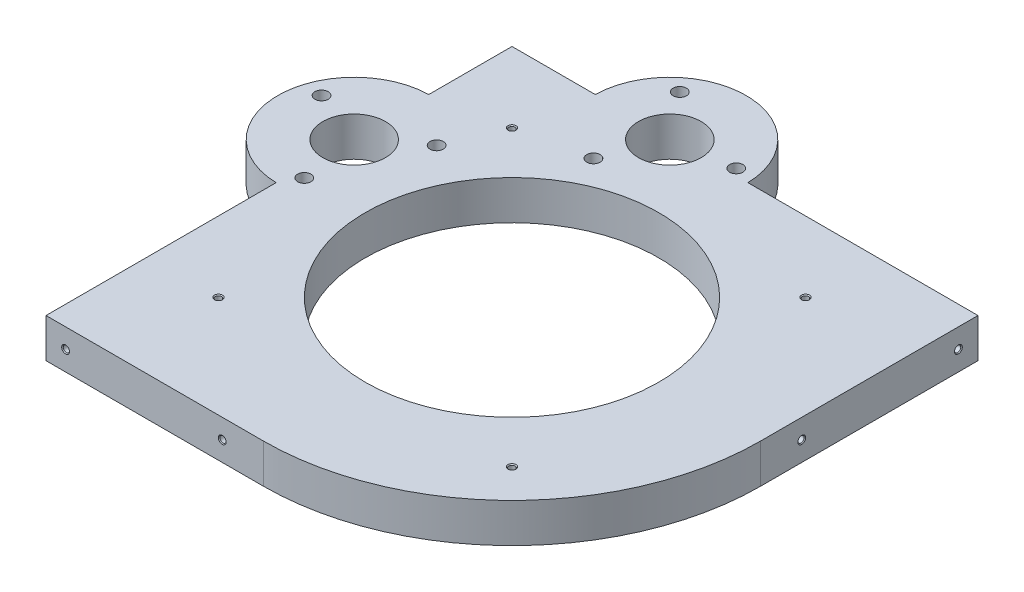
from build123d import *

# Parameters (mm, degrees)
SKETCH1_R                           = 37.5
BOSS_EXTRUDE1_DEPTH                 = 10
M2X0_4_TAPPED_HOLE2_D               = 1.6
M2X0_4_TAPPED_HOLE2_CSINK_D         = 2.05
M2X0_4_TAPPED_HOLE2_CSINK_ANGLE     = 90
M2X0_4_TAPPED_HOLE1_D               = 1.6
M2X0_4_TAPPED_HOLE1_DEPTH           = 6
M2X0_4_TAPPED_HOLE1_TIP             = 0.480688495
M2X0_4_TAPPED_HOLE1_ON_FACE_2_D     = 1.6
M2X0_4_TAPPED_HOLE1_ON_FACE_2_DEPTH = 6
M2X0_4_TAPPED_HOLE1_ON_FACE_2_TIP   = 0.480688495
CHAMFER1_SIZE                       = 0.2
SKETCH11_R                          = 19.5
BOSS_EXTRUDE2_DEPTH                 = 10
SKETCH12_R                          = 8
CUT_EXTRUDE1_DEPTH                  = 106.913751518
M3_CLEARANCE_HOLE1_D                = 3.4


with BuildPart() as part:
    # Sketch1 → Boss-Extrude1 (new body)
    with BuildSketch(Plane(origin=(0, 0, 0), x_dir=(1, 0, 0), z_dir=(0, 1, 0))):
        with BuildLine():
            Line((-55.5, 55.5), (63.5, 55.5))
            Line((63.5, 55.5), (63.5, 0))
            ThreePointArc((63.5, 0), (44.901280605, -44.901280605), (0, -63.5))
            Line((0, -63.5), (-55.5, -63.5))
            Line((-55.5, -63.5), (-55.5, 55.5))
        make_face()
        with Locations(Location((0, 0, 0), (0, 0, 270))):
            Circle(SKETCH1_R, mode=Mode.SUBTRACT)
    extrude(amount=BOSS_EXTRUDE1_DEPTH)

    # M2x0.4 Tapped Hole2 (through all)
    with Locations(Plane(origin=(0, 10, 0), x_dir=(1, 0, 0), z_dir=(0, 1, 0))):
        with Locations((37.476659403, 37.476659403), (-37.476659403, 37.476659403), (-37.476659403, -37.476659403), (37.476659403, -37.476659403)):
            CounterSinkHole(M2X0_4_TAPPED_HOLE2_D / 2, M2X0_4_TAPPED_HOLE2_CSINK_D / 2, counter_sink_angle=M2X0_4_TAPPED_HOLE2_CSINK_ANGLE)

    # M2x0.4 Tapped Hole1
    with Locations(Plane(origin=(63.5, 5, -50.5), x_dir=(0, 0, 1), z_dir=(1, 0, 0))):
        with Locations((0, 0), (40, 0)):
            Hole(M2X0_4_TAPPED_HOLE1_D / 2, depth=M2X0_4_TAPPED_HOLE1_DEPTH)
            with Locations((0, 0, -(M2X0_4_TAPPED_HOLE1_DEPTH + M2X0_4_TAPPED_HOLE1_TIP / 2))):  # 118° drill point
                Cone(0, M2X0_4_TAPPED_HOLE1_D / 2, M2X0_4_TAPPED_HOLE1_TIP, mode=Mode.SUBTRACT)

    # M2x0.4 Tapped Hole1 on face 2
    with Locations(Plane(origin=(-50.5, 5, 63.5), x_dir=(1, 0, 0), z_dir=(0, 0, 1))):
        with Locations((0, 0), (40, 0)):
            Hole(M2X0_4_TAPPED_HOLE1_ON_FACE_2_D / 2, depth=M2X0_4_TAPPED_HOLE1_ON_FACE_2_DEPTH)
            with Locations((0, 0, -(M2X0_4_TAPPED_HOLE1_ON_FACE_2_DEPTH + M2X0_4_TAPPED_HOLE1_ON_FACE_2_TIP / 2))):  # 118° drill point
                Cone(0, M2X0_4_TAPPED_HOLE1_ON_FACE_2_D / 2, M2X0_4_TAPPED_HOLE1_ON_FACE_2_TIP, mode=Mode.SUBTRACT)

    # Chamfer1
    chamfer1_edges = [part.edges().sort_by_distance(p)[0] for p in [
        (-9.7, 5, 63.5),
        (-49.7, 5, 63.5),
        (63.5, 5, -9.7),
        (63.5, 5, -49.7),
    ]]
    chamfer(chamfer1_edges, length=CHAMFER1_SIZE)

    # Sketch11 → Boss-Extrude2 (add, through all)
    with BuildSketch(Plane(origin=(0, 10, 0), x_dir=(1, 0, 0), z_dir=(0, 1, 0))):
        with Locations((-14.752685571, 55.057772098)):
            Circle(SKETCH11_R)
        with Locations((-55.057772098, 14.752685571)):
            Circle(SKETCH11_R)
    extrude(amount=-BOSS_EXTRUDE2_DEPTH)

    # Sketch12 → Cut-Extrude1 (cut, through all)
    with BuildSketch(Plane(origin=(0, 10, 0), x_dir=(1, 0, 0), z_dir=(0, 1, 0))):
        with Locations(Location((-14.752685571, 55.057772098, 0), (0, 0, 270))):
            Circle(SKETCH12_R)
        with Locations(Location((-55.057772098, 14.752685571, 0), (0, 0, 270))):
            Circle(SKETCH12_R)
    extrude(amount=-CUT_EXTRUDE1_DEPTH, mode=Mode.SUBTRACT)

    # M3 Clearance Hole1 (through all)
    with Locations(Plane(origin=(1225.129186233, 0, -788.179357161), x_dir=(0.12314040674573719, 0, 0.992389258419545), z_dir=(0, -1, 0))):
        with Locations((602.6321738, 1378.806890422), (624.895157282, 1365.414371373), (602.165403824, 1352.830321638), (587.985457399, 1327.987745968), (574.59293835, 1305.724762486), (562.008888615, 1328.454515944)):
            Hole(M3_CLEARANCE_HOLE1_D / 2)


solid = part.part
